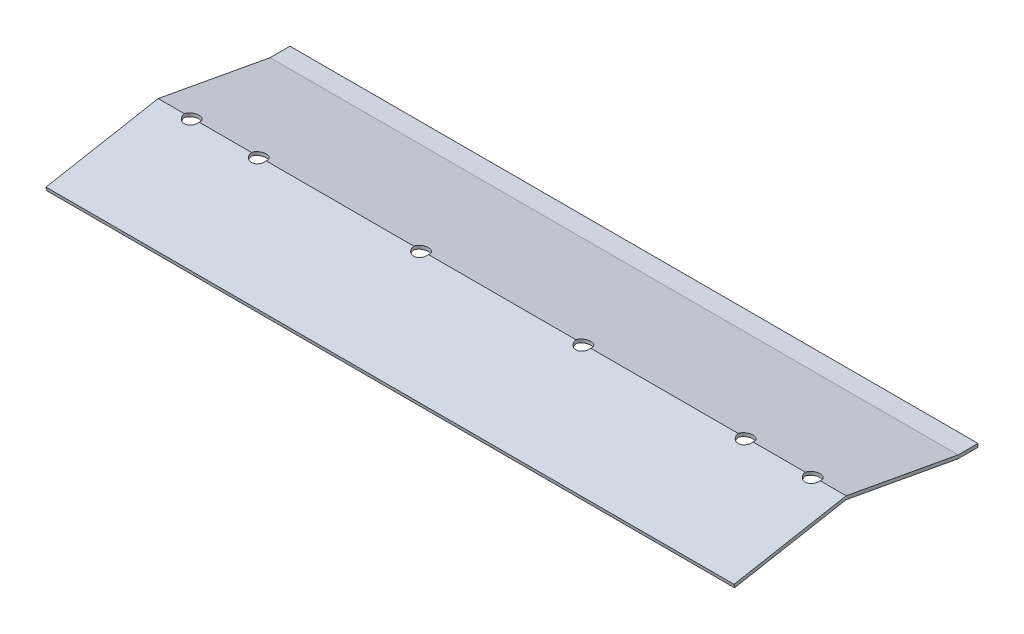
from build123d import *

# Parameters (mm, degrees)
BOSS_EXTRUDE1_DEPTH     = 1026
CUT_EXTRUDE1_DEPTH      = 5875.695454102
CUT_EXTRUDE1_DEPTH_BACK = 5875.695454102
SKETCH2_R               = 11


with BuildPart() as part:
    # Sketch1 → Boss-Extrude1 (new body)
    with BuildSketch(Plane(origin=(0, 0, 0), x_dir=(0, 0, -1), z_dir=(1, 0, 0))):
        Polygon((-5649.138897543, -1238.689665232), (-5481.830586551, -1208.005375509), (-5314.923755358, -1238.623896007), (-5285.330586551, -1238.623896007), (-5285.330586551, -1243.623896007), (-5315.330586551, -1243.623896007), (-5481.830586551, -1213.072021383), (-5648.330586551, -1243.623896007), align=None)
    extrude(amount=BOSS_EXTRUDE1_DEPTH)

    # Sketch2 → Cut-Extrude1 (cut, two sides: drawn at the far end of the back side and taken through both)
    with BuildSketch(Plane(origin=(0, 0, 0), x_dir=(1, 0, 0), z_dir=(0, 1, 0)).offset(-CUT_EXTRUDE1_DEPTH_BACK)):
        with Locations((50, -5481.830586551)):
            Circle(SKETCH2_R)
        with Locations((150, -5481.830586551)):
            Circle(SKETCH2_R)
        with Locations((976, -5481.830586551)):
            Circle(SKETCH2_R)
        with Locations((876, -5481.830586551)):
            Circle(SKETCH2_R)
        with Locations((634, -5481.830586551)):
            Circle(SKETCH2_R)
        with Locations((392, -5481.830586551)):
            Circle(SKETCH2_R)
    extrude(amount=CUT_EXTRUDE1_DEPTH + CUT_EXTRUDE1_DEPTH_BACK, mode=Mode.SUBTRACT)


solid = part.part
